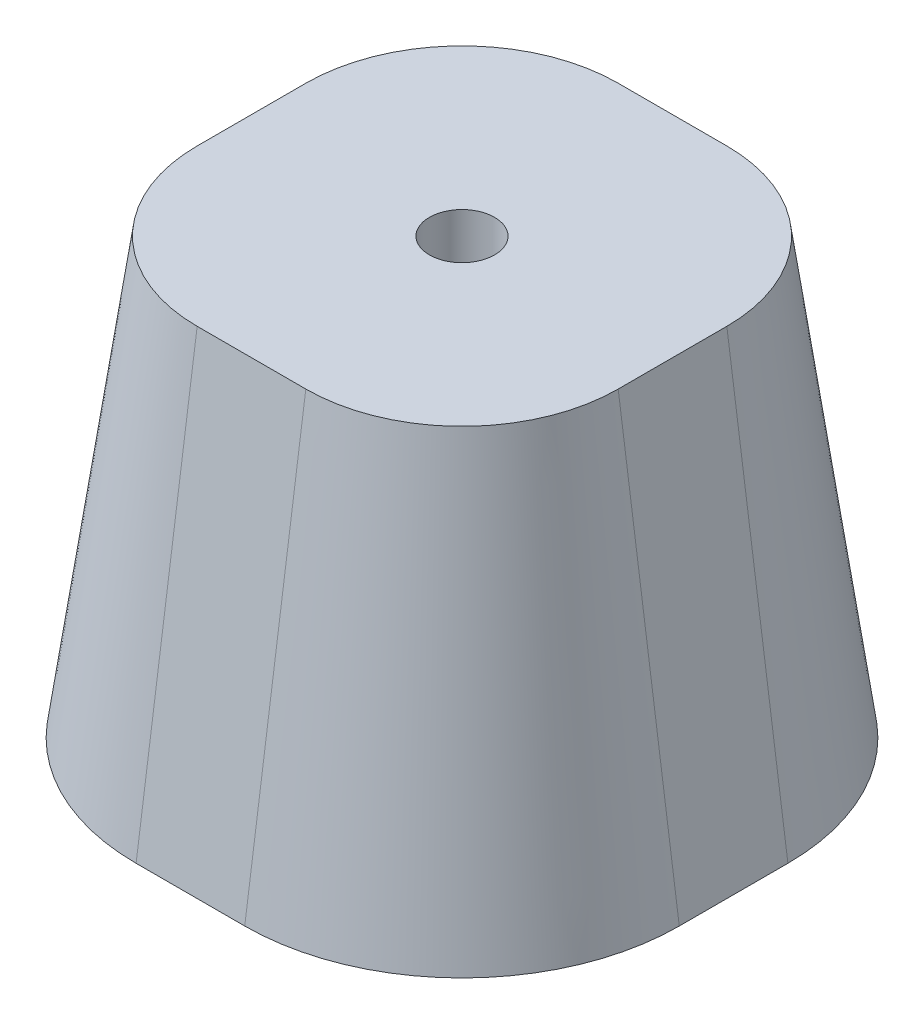
from build123d import *

# Parameters (mm, degrees)
BODY_DEPTH  = 20
BODY_TAPER  = 8
SKETCH2_R   = 1.5
SCREW_DEPTH = 8


with BuildPart() as part:
    # Sketch1 → Body (new body)
    with BuildSketch(Plane(origin=(0, 0, 0), x_dir=(1, 0, 0), z_dir=(0, 1, 0))):
        with BuildLine():
            ThreePointArc((2.5, -12.5), (9.571067812, -9.571067812), (12.5, -2.5))
            Line((12.5, -2.5), (12.5, 2.5))
            ThreePointArc((12.5, 2.5), (9.571067812, 9.571067812), (2.5, 12.5))
            Line((2.5, 12.5), (-2.5, 12.5))
            ThreePointArc((-2.5, 12.5), (-9.571067812, 9.571067812), (-12.5, 2.5))
            Line((-12.5, 2.5), (-12.5, -2.5))
            ThreePointArc((-12.5, -2.5), (-9.571067812, -9.571067812), (-2.5, -12.5))
            Line((-2.5, -12.5), (2.5, -12.5))
        make_face()
    extrude(amount=BODY_DEPTH, taper=BODY_TAPER)

    # Sketch2 → Screw (cut)
    with BuildSketch(Plane(origin=(0, 20, 0), x_dir=(1, 0, 0), z_dir=(0, 1, 0))):
        with Locations(Location((0, 0, 0), (0, 0, 270))):
            Circle(SKETCH2_R)
    extrude(amount=-SCREW_DEPTH, mode=Mode.SUBTRACT)


solid = part.part
